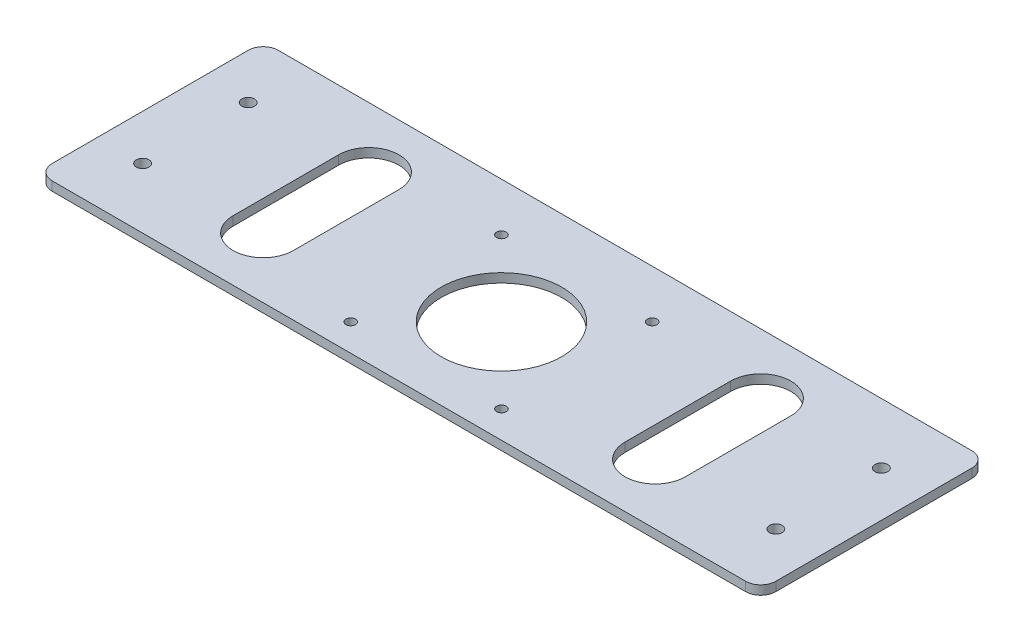
from build123d import *

# Parameters (mm, degrees)
SKETCH_1_W          = 400
SKETCH_1_H          = 60
SKETCH_1_R          = 1.6
SKETCH_1_W_2        = 21
SKETCH_1_H_2        = 21
SKETCH_1_W_3        = 240
SKETCH_1_H_3        = 75
SKETCH_1_R_2        = 20
EXTRUDE_1484_DEPTH  = 3
SKETCH_2_R          = 2.05
SKETCH_2_R_2        = 2.1
CUT_EXTRUDE_1_DEPTH = 250.229009796
FILLET_1_R          = 5
SKETCH1_R           = 2.1
CUT_EXTRUDE4_DEPTH  = 250.229009796
CUT_EXTRUDE_2_DEPTH = 10
FILLET_2_R          = 5


with BuildPart() as part:
    # 草图1 → Extrude 1484 (new body)
    # profile 1 of 2: a face of its own
    with BuildSketch(Plane(origin=(0, 0, 0), x_dir=(1, 0, 0), z_dir=(0, 1, 0))):
        with Locations((32.825924772, 16.128249268)):
            Rectangle(SKETCH_1_W, SKETCH_1_H)
        with Locations(Location((-14.674075228, 36.128249268, 0), (0, 0, 270))):
            Circle(SKETCH_1_R, mode=Mode.SUBTRACT)
        with Locations(Location((-14.674075228, 11.128249268, 0), (0, 0, 270))):
            Circle(SKETCH_1_R, mode=Mode.SUBTRACT)
        with Locations(Location((80.325924772, 11.128249268, 0), (0, 0, 270))):
            Circle(SKETCH_1_R, mode=Mode.SUBTRACT)
        with Locations(Location((80.325924772, 36.128249268, 0), (0, 0, 270))):
            Circle(SKETCH_1_R, mode=Mode.SUBTRACT)
        with Locations((32.825924772, 10.628249268)):
            Rectangle(SKETCH_1_W_2, SKETCH_1_H_2, mode=Mode.SUBTRACT)
    # profile 2 of 2: a face of its own
    with BuildSketch(Plane(origin=(0, 0, 0), x_dir=(1, 0, 0), z_dir=(0, 1, 0))):
        with Locations((32.825924772, -51.371750732)):
            Rectangle(SKETCH_1_W_3, SKETCH_1_H_3)
        with Locations(Location((7.825924772, -29.871750732, 0), (0, 0, 270))):
            Circle(SKETCH_1_R, mode=Mode.SUBTRACT)
        with Locations(Location((7.825924772, -79.871750732, 0), (0, 0, 270))):
            Circle(SKETCH_1_R, mode=Mode.SUBTRACT)
        with Locations(Location((57.825924772, -79.871750732, 0), (0, 0, 270))):
            Circle(SKETCH_1_R, mode=Mode.SUBTRACT)
        with Locations(Location((57.825924772, -29.871750732, 0), (0, 0, 270))):
            Circle(SKETCH_1_R, mode=Mode.SUBTRACT)
        with Locations(Location((32.825924772, -54.871750732, 0), (0, 0, 270))):
            Circle(SKETCH_1_R_2, mode=Mode.SUBTRACT)
    extrude(amount=EXTRUDE_1484_DEPTH)

    # 草图2 → 切除-拉伸1 (cut, through all)
    with BuildSketch(Plane(origin=(0, 3, 0), x_dir=(1, 0, 0), z_dir=(0, 1, 0))):
        with Locations(Location((-149.174075228, 29.628249268, 0), (0, 0, 270))):
            Circle(SKETCH_2_R)
        with Locations(Location((-149.174075228, 2.628249268, 0), (0, 0, 270))):
            Circle(SKETCH_2_R)
        with Locations(Location((-121.674075228, 29.628249268, 0), (0, 0, 270))):
            Circle(SKETCH_2_R)
        with Locations(Location((-121.674075228, 2.628249268, 0), (0, 0, 90))):
            Circle(SKETCH_2_R)
        with Locations(Location((-51.674075228, 41.128249268, 0), (0, 0, 270))):
            Circle(SKETCH_2_R_2)
        with Locations(Location((-86.674075228, 41.128249268, 0), (0, 0, 270))):
            Circle(SKETCH_2_R_2)
        with Locations(Location((-51.674075228, -8.871750732, 0), (0, 0, 90))):
            Circle(SKETCH_2_R_2)
        with Locations(Location((-86.674075228, -8.871750732, 0), (0, 0, 90))):
            Circle(SKETCH_2_R_2)
        with Locations(Location((-135.424075228, 41.128249268, 0), (0, 0, 270))):
            Circle(SKETCH_2_R_2)
        with Locations(Location((-135.424075228, -8.871750732, 0), (0, 0, 90))):
            Circle(SKETCH_2_R_2)
        with Locations(Location((201.075924772, -8.871750732, 0), (0, 0, 270))):
            Circle(SKETCH_2_R_2)
        with Locations(Location((201.075924772, 41.128249268, 0), (0, 0, 90))):
            Circle(SKETCH_2_R_2)
        with Locations(Location((152.325924772, -8.871750732, 0), (0, 0, 270))):
            Circle(SKETCH_2_R_2)
        with Locations(Location((117.325924772, -8.871750732, 0), (0, 0, 270))):
            Circle(SKETCH_2_R_2)
        with Locations(Location((152.325924772, 41.128249268, 0), (0, 0, 90))):
            Circle(SKETCH_2_R_2)
        with Locations(Location((117.325924772, 41.128249268, 0), (0, 0, 90))):
            Circle(SKETCH_2_R_2)
        with Locations(Location((187.325924772, 2.628249268, 0), (0, 0, 270))):
            Circle(SKETCH_2_R)
        with Locations(Location((187.325924772, 29.628249268, 0), (0, 0, 90))):
            Circle(SKETCH_2_R)
        with Locations(Location((214.825924772, 2.628249268, 0), (0, 0, 90))):
            Circle(SKETCH_2_R)
        with Locations(Location((214.825924772, 29.628249268, 0), (0, 0, 90))):
            Circle(SKETCH_2_R)
    extrude(amount=-CUT_EXTRUDE_1_DEPTH, mode=Mode.SUBTRACT)

    # 圆角1
    fillet_1_edges = [part.edges().sort_by_distance(p)[0] for p in [
        (-167.174075228, 1.5, 13.871750732),
        (-167.174075228, 1.5, -46.128249268),
        (232.825924772, 1.5, -46.128249268),
        (232.825924772, 1.5, 13.871750732),
        (152.825924772, 1.5, 13.871750732),
        (152.825924772, 1.5, 88.871750732),
        (-87.174075228, 1.5, 88.871750732),
        (-87.174075228, 1.5, 13.871750732),
    ]]
    fillet(fillet_1_edges, radius=FILLET_1_R)

    # Sketch1 → Cut-Extrude4 (cut, through all)
    with BuildSketch(Plane(origin=(0, 0, 0), x_dir=(1, 0, 0), z_dir=(0, 1, 0))):
        with Locations(Location((-72.174075228, -33.871750732, 0), (0, 0, 270))):
            Circle(SKETCH1_R)
        with Locations(Location((-72.174075228, -68.871750732, 0), (0, 0, 270))):
            Circle(SKETCH1_R)
        with Locations(Location((137.825924772, -68.871750732, 0), (0, 0, 90))):
            Circle(SKETCH1_R)
        with Locations(Location((137.825924772, -33.871750732, 0), (0, 0, 90))):
            Circle(SKETCH1_R)
        with BuildLine():
            Line((-42.174075228, -68.871750732), (-42.174075228, -33.871750732))
            ThreePointArc((-42.174075228, -33.871750732), (-32.174075228, -23.871750732), (-22.174075228, -33.871750732))
            Line((-22.174075228, -33.871750732), (-22.174075228, -68.871750732))
            ThreePointArc((-22.174075228, -68.871750732), (-32.174075228, -78.871750732), (-42.174075228, -68.871750732))
        make_face()
        with BuildLine():
            Line((107.825924772, -68.871750732), (107.825924772, -33.871750732))
            ThreePointArc((107.825924772, -33.871750732), (97.825924772, -23.871750732), (87.825924772, -33.871750732))
            Line((87.825924772, -33.871750732), (87.825924772, -68.871750732))
            ThreePointArc((87.825924772, -68.871750732), (97.825924772, -78.871750732), (107.825924772, -68.871750732))
        make_face()
    extrude(amount=CUT_EXTRUDE4_DEPTH, mode=Mode.SUBTRACT)

    # 草图3 → 切除-拉伸2 (cut)
    with BuildSketch(Plane(origin=(0, 3, 0), x_dir=(1, 0, 0), z_dir=(0, 1, 0))):
        with BuildLine():
            Line((227.825924772, 46.128249268), (-162.174075228, 46.128249268))
            ThreePointArc((-162.174075228, 46.128249268), (-165.709609134, 44.663783174), (-167.174075228, 41.128249268))
            Line((-167.174075228, 41.128249268), (-167.174075228, -8.871750732))
            ThreePointArc((-167.174075228, -8.871750732), (-165.709609134, -12.407284637), (-162.174075228, -13.871750732))
            Line((-162.174075228, -13.871750732), (-92.174075228, -13.871750732))
            Line((-92.174075228, -13.871750732), (157.825924772, -13.871750732))
            Line((157.825924772, -13.871750732), (227.825924772, -13.871750732))
            ThreePointArc((227.825924772, -13.871750732), (231.361458678, -12.407284637), (232.825924772, -8.871750732))
            Line((232.825924772, -8.871750732), (232.825924772, 41.128249268))
            ThreePointArc((232.825924772, 41.128249268), (231.361458678, 44.663783174), (227.825924772, 46.128249268))
        make_face()
        with BuildLine():
            Line((-87.174075228, -13.871750732), (-92.174075228, -13.871750732))
            ThreePointArc((-92.174075228, -13.871750732), (-88.638541322, -15.336216826), (-87.174075228, -18.871750732))
            Line((-87.174075228, -18.871750732), (-87.174075228, -13.871750732))
        make_face()
        with BuildLine():
            Line((157.825924772, -13.871750732), (152.825924772, -13.871750732))
            Line((152.825924772, -13.871750732), (152.825924772, -18.871750732))
            ThreePointArc((152.825924772, -18.871750732), (154.290390866, -15.336216826), (157.825924772, -13.871750732))
        make_face()
    extrude(amount=-CUT_EXTRUDE_2_DEPTH, mode=Mode.SUBTRACT)

    # 圆角2
    fillet_2_edges = [part.edges().sort_by_distance(p)[0] for p in [
        (152.825924772, 1.5, 13.871750732),
        (-87.174075228, 1.5, 13.871750732),
    ]]
    fillet(fillet_2_edges, radius=FILLET_2_R)


solid = part.part
